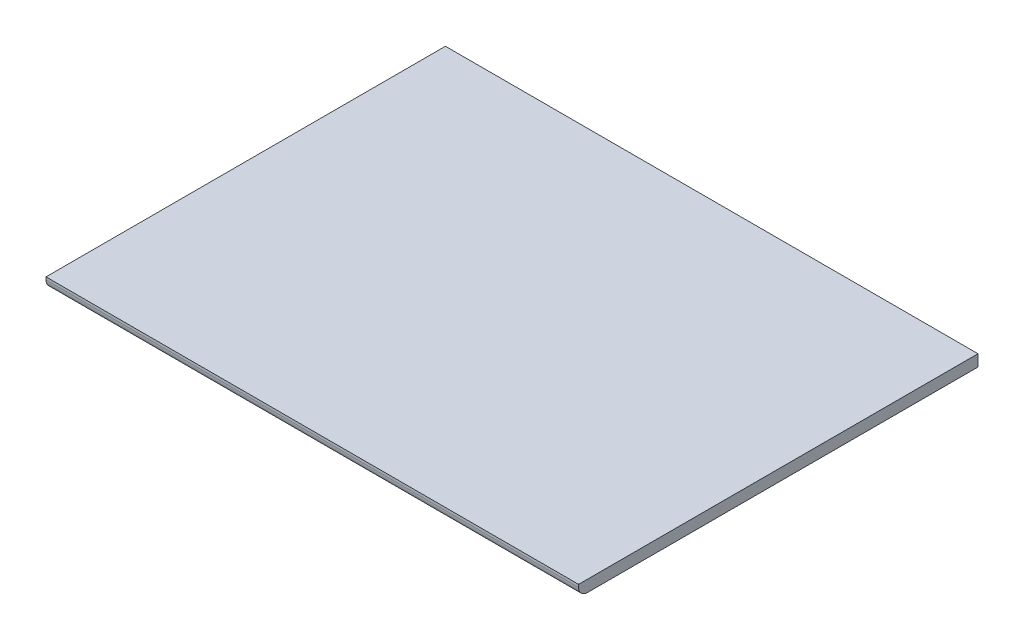
from build123d import *

# Parameters (mm, degrees)
SKETCH_1_W      = 14.75
SKETCH_1_H      = 8
EXTRUDE_1_DEPTH = 1.2
SKETCH_2_W      = 14.75
SKETCH_2_H      = 3.9
EXTRUDE_2_DEPTH = 1.55
SKETCH_3_W      = 60
SKETCH_3_H      = 45
EXTRUDE_3_DEPTH = 1.3
FILLET_1_R      = 3
FILLET_2_R      = 1
FILLET_3_R      = 1


with BuildPart() as part:
    # 草图1 → 凸台-拉伸1 (new body)
    with BuildSketch(Plane(origin=(0, 0, 0), x_dir=(1, 0, 0), z_dir=(0, 1, 0))):
        Rectangle(SKETCH_1_W, SKETCH_1_H)
    extrude(amount=EXTRUDE_1_DEPTH)

    # 草图2 → 凸台-拉伸2 (add)
    with BuildSketch(Plane(origin=(0, 1.2, 0), x_dir=(1, 0, 0), z_dir=(0, 1, 0))):
        with Locations((0, 2.05)):
            Rectangle(SKETCH_2_W, SKETCH_2_H)
    extrude(amount=EXTRUDE_2_DEPTH)

    # 草图3 → 凸台-拉伸3 (add)
    with BuildSketch(Plane(origin=(0, 2.75, 0), x_dir=(1, 0, 0), z_dir=(0, 1, 0))):
        with Locations((0, -18.5)):
            Rectangle(SKETCH_3_W, SKETCH_3_H)
    extrude(amount=EXTRUDE_3_DEPTH)

    # 圆角1
    fillet_1_edges = [part.edges().sort_by_distance(p)[0] for p in [
        (0, 0, -4),
    ]]
    fillet(fillet_1_edges, radius=FILLET_1_R)

    # 圆角2
    fillet_2_edges = [part.edges().sort_by_distance(p)[0] for p in [
        (0, 1.2, 4),
    ]]
    fillet(fillet_2_edges, radius=FILLET_2_R)

    # 圆角3
    fillet_3_edges = [part.edges().sort_by_distance(p)[0] for p in [
        (0, 2.75, 41),
    ]]
    fillet(fillet_3_edges, radius=FILLET_3_R)


solid = part.part
